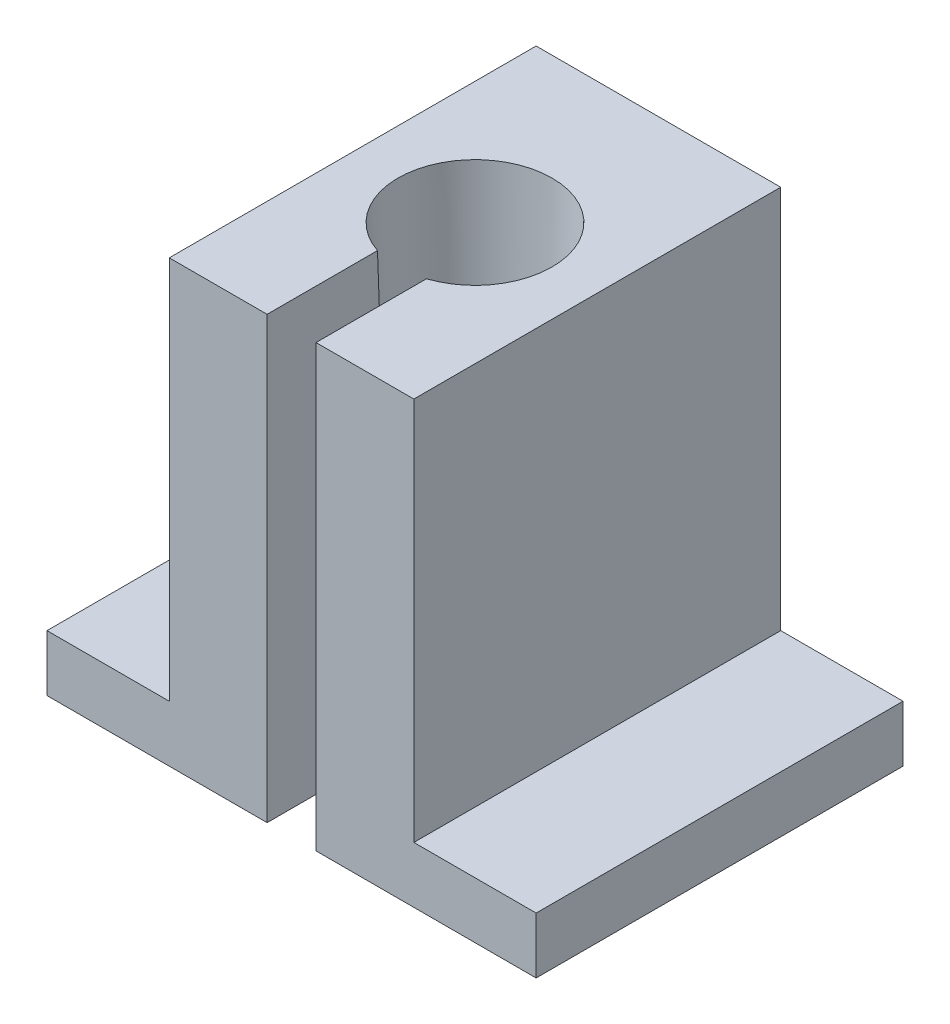
from build123d import *

# Parameters (mm, degrees)
SKETCH1_W           = 10
SKETCH1_H           = 18
BOSS_EXTRUDE1_DEPTH = 15
SKETCH3_W           = 5
SKETCH3_H           = 2.3
BOSS_EXTRUDE2_DEPTH = 15
SKETCH4_R           = 3.15
CUT_EXTRUDE1_DEPTH  = 26.475478406
SKETCH6_W           = 2
SKETCH6_H           = 18
CUT_EXTRUDE2_DEPTH  = 8
DRAFT4_ANGLE        = 2


with BuildPart() as part:
    # Sketch1 → Boss-Extrude1 (new body)
    with BuildSketch(Plane.XY):
        Rectangle(SKETCH1_W, SKETCH1_H)
    extrude(amount=BOSS_EXTRUDE1_DEPTH)

    # Sketch3 → Boss-Extrude2 (add)
    with BuildSketch(Plane.XY.offset(15)):
        with Locations((-7.5, -7.85)):
            Rectangle(SKETCH3_W, SKETCH3_H)
        with Locations((7.5, -7.85)):
            Rectangle(SKETCH3_W, SKETCH3_H)
    extrude(amount=-BOSS_EXTRUDE2_DEPTH)

    # Sketch4 → Cut-Extrude1 (cut, through all)
    with BuildSketch(Plane.XZ.offset(9)):
        with Locations(Location((0, 7.5, 0), (0, 0, 270))):
            Circle(SKETCH4_R)
    extrude(amount=-CUT_EXTRUDE1_DEPTH, mode=Mode.SUBTRACT)

    # Sketch6 → Cut-Extrude2 (cut)
    with BuildSketch(Plane.XY.offset(15)):
        Rectangle(SKETCH6_W, SKETCH6_H)
    extrude(amount=-CUT_EXTRUDE2_DEPTH, mode=Mode.SUBTRACT)

    # Draft4
    draft4_faces = [part.faces().sort_by_distance(p)[0] for p in [
        (0, 0, 4.35),
    ]]
    draft(draft4_faces, Plane(origin=(-5, 9, 15), x_dir=(0, 0, 1), z_dir=(0, 1, 0)), DRAFT4_ANGLE)


solid = part.part
